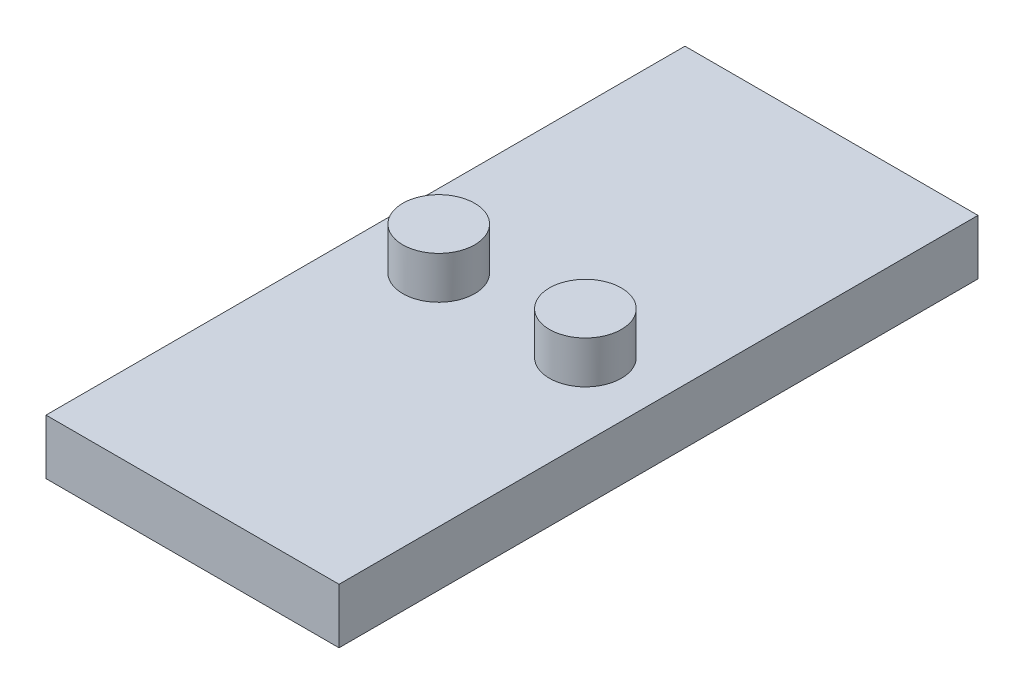
from build123d import *

# Parameters (mm, degrees)
SKETCH1_W           = 69.2
SKETCH1_H           = 150.88406761
BOSS_EXTRUDE1_DEPTH = 13
BOSS_EXTRUDE2_DEPTH = 10


with BuildPart() as part:
    # Sketch1 → Boss-Extrude1 (new body)
    with BuildSketch(Plane(origin=(0, 0, 0), x_dir=(1, 0, 0), z_dir=(0, 1, 0))):
        Rectangle(SKETCH1_W, SKETCH1_H)
    extrude(amount=BOSS_EXTRUDE1_DEPTH)

    # Sketch2 → Boss-Extrude2 (add)
    with BuildSketch(Plane(origin=(0, 13, 0), x_dir=(1, 0, 0), z_dir=(0, 1, 0))):
        with BuildLine():
            ThreePointArc((-25.795, 0), (-17.3, -8.495), (-8.805, 0))
            Line((-8.805, 0), (-25.795, 0))
        make_face()
        with BuildLine():
            Line((-25.795, 0), (-8.805, 0))
            ThreePointArc((-8.805, 0), (-17.3, 8.495), (-25.795, 0))
        make_face()
        with BuildLine():
            ThreePointArc((25.820118221, 0.00925204), (17.327393087, 8.504251736), (8.83011944, 0.013801772))
            Line((8.83011944, 0.013801772), (25.820117003, 0.004702309))
            ThreePointArc((25.820117003, 0.004702309), (25.820117917, 0.006977175), (25.820118221, 0.00925204))
        make_face()
        with BuildLine():
            Line((25.820117003, 0.004702309), (8.83011944, 0.013801772))
            ThreePointArc((8.83011944, 0.013801772), (17.32056849, -8.485746741), (25.820117003, 0.004702309))
        make_face()
    extrude(amount=BOSS_EXTRUDE2_DEPTH)


solid = part.part
